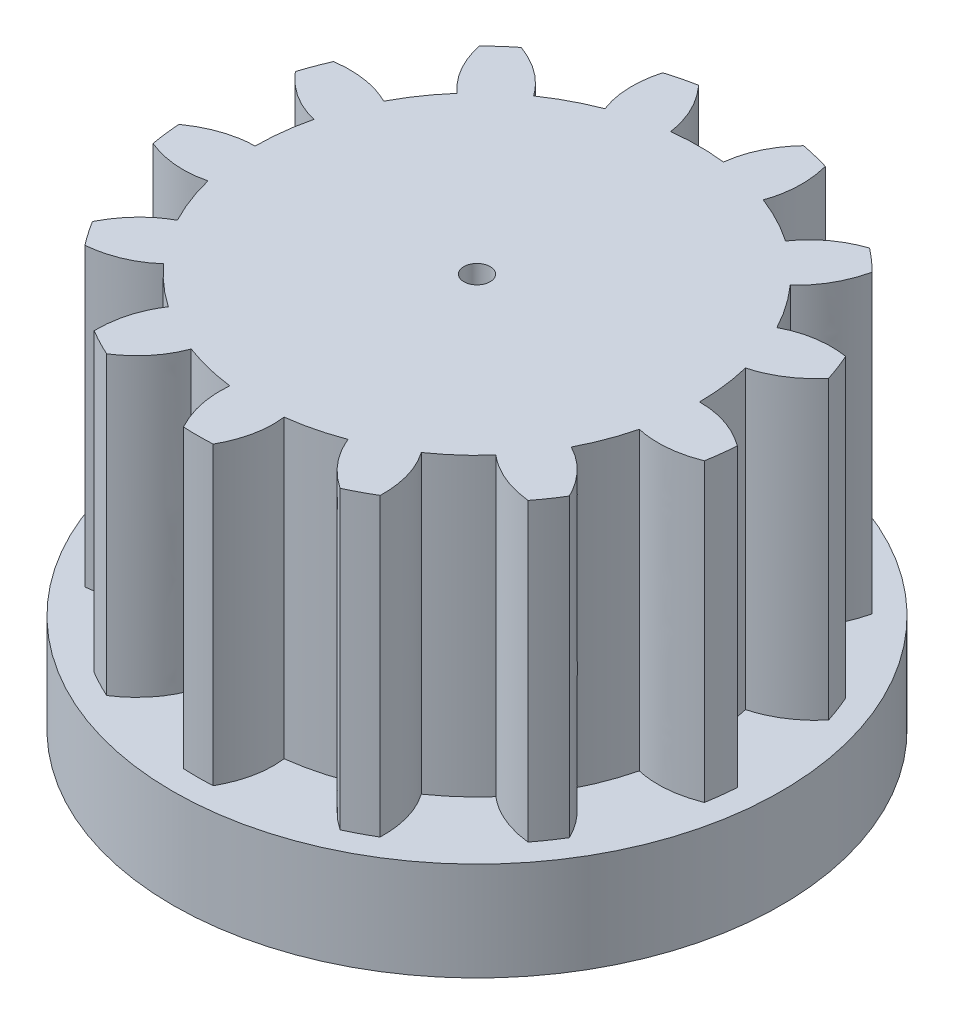
from build123d import *

# Parameters (mm, degrees)
SKETCH1_R             = 0.4
BOSS_EXTRUDE1_DEPTH   = 9
SKETCH2_R             = 9.25
BOSS_EXTRUDE2_DEPTH   = 3
CROQUIS1_R            = 2.3
CORTAR_EXTRUIR1_DEPTH = 2


with BuildPart() as part:
    # Sketch1 → Boss-Extrude1 (new body)
    with BuildSketch(Plane(origin=(0, 0, 0), x_dir=(1, 0, 0), z_dir=(0, 1, 0))):
        with BuildLine():
            add(Edge.make_bspline(
                [(-5.065227978, 4.461610195), (-5.526615005, 4.86619147), (-5.830003112, 5.39406146), (-5.975392301, 6.045220165)],
                knots=[0, 0, 0, 0, 0.872429449, 0.872429449, 0.872429449, 0.872429449], degree=3))
            ThreePointArc((-5.065227978, 4.461610195), (-5.560258819, 3.827012132), (-5.976238464, 3.138004752))
            add(Edge.make_bspline(
                [(-7.780961116, 3.42149735), (-7.125870497, 3.507536778), (-6.52429628, 3.413039245), (-5.976238464, 3.138004752)],
                knots=[0.127683247, 0.127683247, 0.127683247, 0.127683247, 1, 1, 1, 1], degree=3))
            ThreePointArc((-7.780961116, 3.42149735), (-7.951879756, 3.00293329), (-8.10030101, 2.575873357))
            add(Edge.make_bspline(
                [(-6.558450277, 1.596630818), (-7.155006493, 1.740452504), (-7.668956737, 2.066866683), (-8.10030101, 2.575873357)],
                knots=[0, 0, 0, 0, 0.872429449, 0.872429449, 0.872429449, 0.872429449], degree=3))
            ThreePointArc((-6.558450277, 1.596630818), (-6.701865893, 0.804669837), (-6.749999881, 0.00126872))
            add(Edge.make_bspline(
                [(-8.479748007, -0.586407486), (-7.939678588, -0.205787566), (-7.363095879, -0.009895497), (-6.749999881, 0.00126872)],
                knots=[0.127683247, 0.127683247, 0.127683247, 0.127683247, 1, 1, 1, 1], degree=3))
            ThreePointArc((-8.479748007, -0.586407486), (-8.436572529, -1.036457408), (-8.369528376, -1.483574994))
            add(Edge.make_bspline(
                [(-6.549210655, -1.634117437), (-7.144272221, -1.784003157), (-7.751044795, -1.733822342), (-8.369528376, -1.483574994)],
                knots=[0, 0, 0, 0, 0.872429449, 0.872429449, 0.872429449, 0.872429449], degree=3))
            ThreePointArc((-6.549210655, -1.634117437), (-6.308156258, -2.402012621), (-5.977417671, -3.13575796))
            add(Edge.make_bspline(
                [(-7.235926822, -4.459973434), (-6.934601997, -3.871968458), (-6.515098947, -3.4305633), (-5.977417671, -3.13575796)],
                knots=[0.127683247, 0.127683247, 0.127683247, 0.127683247, 1, 1, 1, 1], degree=3))
            ThreePointArc((-7.235926822, -4.459973434), (-6.988548208, -4.838408204), (-6.721397655, -5.203154193))
            add(Edge.make_bspline(
                [(-5.039625799, -4.490509081), (-5.496871281, -4.899765193), (-6.0574619, -5.137313564), (-6.721397655, -5.203154193)],
                knots=[0, 0, 0, 0, 0.872429449, 0.872429449, 0.872429449, 0.872429449], degree=3))
            ThreePointArc((-5.039625799, -4.490509081), (-4.469324045, -5.058422935), (-3.835481109, -5.554420281))
            add(Edge.make_bspline(
                [(-4.334442004, -7.311813216), (-4.34089166, -6.651128039), (-4.174571361, -6.065330394), (-3.835481109, -5.554420281)],
                knots=[0.127683247, 0.127683247, 0.127683247, 0.127683247, 1, 1, 1, 1], degree=3))
            ThreePointArc((-4.334442004, -7.311813216), (-3.939531713, -7.53193799), (-3.533475733, -7.730753472))
            add(Edge.make_bspline(
                [(-2.375523406, -6.318179211), (-2.590203375, -6.893050073), (-2.976187484, -7.36390816), (-3.533475733, -7.730753472)],
                knots=[0, 0, 0, 0, 0.872429449, 0.872429449, 0.872429449, 0.872429449], degree=3))
            ThreePointArc((-2.375523406, -6.318179211), (-1.606623554, -6.556009515), (-0.814882047, -6.700631854))
            add(Edge.make_bspline(
                [(-0.439988759, -8.488604708), (-0.752735357, -7.906594341), (-0.877699786, -7.31060339), (-0.814882047, -6.700631854)],
                knots=[0.127683247, 0.127683247, 0.127683247, 0.127683247, 1, 1, 1, 1], degree=3))
            ThreePointArc((-0.439988759, -8.488604708), (0.011984021, -8.499991552), (0.463922896, -8.487330296))
            add(Edge.make_bspline(
                [(0.832782771, -6.698430626), (0.909848909, -7.307220251), (0.786895617, -7.903520141), (0.463922896, -8.487330296)],
                knots=[0, 0, 0, 0, 0.872429449, 0.872429449, 0.872429449, 0.872429449], degree=3))
            ThreePointArc((0.832782771, -6.698430626), (1.624135031, -6.551693323), (2.392396671, -6.311809421))
            add(Edge.make_bspline(
                [(3.555260608, -7.72075916), (3.007863545, -7.350755165), (2.620242233, -6.881105252), (2.392396671, -6.311809421)],
                knots=[0.127683247, 0.127683247, 0.127683247, 0.127683247, 1, 1, 1, 1], degree=3))
            ThreePointArc((3.555260608, -7.72075916), (3.96075436, -7.520799485), (4.355042381, -7.299562032))
            add(Edge.make_bspline(
                [(3.850308451, -5.54415231), (4.201465773, -6.047394331), (4.369710416, -6.632530905), (4.355042381, -7.299562032)],
                knots=[0, 0, 0, 0, 0.872429449, 0.872429449, 0.872429449, 0.872429449], degree=3))
            ThreePointArc((3.850308451, -5.54415231), (4.482823853, -5.046463148), (5.051606144, -4.477027515))
            add(Edge.make_bspline(
                [(6.736042616, -5.184180734), (6.079397157, -5.110946566), (5.517918333, -4.875228826), (5.051606144, -4.477027515)],
                knots=[0.127683247, 0.127683247, 0.127683247, 0.127683247, 1, 1, 1, 1], degree=3))
            ThreePointArc((6.736042616, -5.184180734), (7.002163607, -4.818682892), (7.24847414, -4.439552076))
            add(Edge.make_bspline(
                [(5.985774866, -3.119775513), (6.530577461, -3.402183249), (6.951477219, -3.84210877), (7.24847414, -4.439552076)],
                knots=[0, 0, 0, 0, 0.872429449, 0.872429449, 0.872429449, 0.872429449], degree=3))
            ThreePointArc((5.985774866, -3.119775513), (6.314551754, -2.385149082), (6.553553527, -1.616612559))
            add(Edge.make_bspline(
                [(8.373678438, -1.459968977), (7.758214146, -1.700281702), (7.151505842, -1.75249623), (6.553553527, -1.616612559)],
                knots=[0.127683247, 0.127683247, 0.127683247, 0.127683247, 1, 1, 1, 1], degree=3))
            ThreePointArc((8.373678438, -1.459968977), (8.439461558, -1.01266412), (8.481367828, -0.562494242))
            add(Edge.make_bspline(
                [(6.749972396, 0.019304256), (7.363612555, 0.022427015), (7.940744366, -0.171505818), (8.481367828, -0.562494242)],
                knots=[0, 0, 0, 0, 0.872429449, 0.872429449, 0.872429449, 0.872429449], degree=3))
            ThreePointArc((6.749972396, 0.019304256), (6.699691947, 0.822573894), (6.554160776, 1.614148852))
            add(Edge.make_bspline(
                [(8.093005444, 2.598704077), (7.65971777, 2.099897208), (7.146769547, 1.771712133), (6.554160776, 1.614148852)],
                knots=[0.127683247, 0.127683247, 0.127683247, 0.127683247, 1, 1, 1, 1], degree=3))
            ThreePointArc((8.093005444, 2.598704077), (7.943380571, 3.025343799), (7.771282357, 3.443424244))
            add(Edge.make_bspline(
                [(5.967832596, 3.153961653), (6.509732754, 3.44189952), (7.110882674, 3.53838705), (7.771282357, 3.443424244)],
                knots=[0, 0, 0, 0, 0.872429449, 0.872429449, 0.872429449, 0.872429449], degree=3))
            ThreePointArc((5.967832596, 3.153961653), (5.550013455, 3.841855105), (5.053288778, 4.475128213))
            add(Edge.make_bspline(
                [(5.958322434, 6.062045345), (5.806472362, 5.419014975), (5.504794477, 4.890042598), (5.053288778, 4.475128213)],
                knots=[0.127683247, 0.127683247, 0.127683247, 0.127683247, 1, 1, 1, 1], degree=3))
            ThreePointArc((5.958322434, 6.062045345), (5.627566824, 6.370281912), (5.280889753, 6.660495734))
            add(Edge.make_bspline(
                [(3.818534268, 5.566084444), (4.16455163, 6.072874324), (4.652003458, 6.437678087), (5.280889753, 6.660495734)],
                knots=[0, 0, 0, 0, 0.872429449, 0.872429449, 0.872429449, 0.872429449], degree=3))
            ThreePointArc((3.818534268, 5.566084444), (3.128893766, 5.98101361), (2.394769219, 6.310909632))
            add(Edge.make_bspline(
                [(2.45865956, 8.136645081), (2.623034112, 7.496701718), (2.601737332, 6.888123235), (2.394769219, 6.310909632)],
                knots=[0.127683247, 0.127683247, 0.127683247, 0.127683247, 1, 1, 1, 1], degree=3))
            ThreePointArc((2.45865956, 8.136645081), (2.022545337, 8.25586521), (1.580708948, 8.351727918))
            add(Edge.make_bspline(
                [(0.794455758, 6.703084368), (0.865321915, 7.312626807), (1.127406312, 7.862174657), (1.580708948, 8.351727918)],
                knots=[0, 0, 0, 0, 0.872429449, 0.872429449, 0.872429449, 0.872429449], degree=3))
            ThreePointArc((0.794455758, 6.703084368), (-0.009017778, 6.749993976), (-0.812363108, 6.700937709))
            add(Edge.make_bspline(
                [(-1.604252589, 8.347237485), (-1.161309642, 7.856984441), (-0.897346481, 7.308217849), (-0.812363108, 6.700937709)],
                knots=[0.127683247, 0.127683247, 0.127683247, 0.127683247, 1, 1, 1, 1], degree=3))
            ThreePointArc((-1.604252589, 8.347237485), (-2.045816912, 8.250129282), (-2.481593228, 8.129679886))
            add(Edge.make_bspline(
                [(-2.411622992, 6.304488444), (-2.632142622, 6.877144615), (-2.655466033, 7.485541762), (-2.481593228, 8.129679886)],
                knots=[0, 0, 0, 0, 0.872429449, 0.872429449, 0.872429449, 0.872429449], degree=3))
            ThreePointArc((-2.411622992, 6.304488444), (-3.144863458, 5.972632069), (-3.833392837, 5.555861712))
            add(Edge.make_bspline(
                [(-5.299649804, 6.645578377), (-4.679611352, 6.417326717), (-4.19085903, 6.054087828), (-3.833392837, 5.555861712)],
                knots=[0.127683247, 0.127683247, 0.127683247, 0.127683247, 1, 1, 1, 1], degree=3))
            ThreePointArc((-5.299649804, 6.645578377), (-5.645507162, 6.35438816), (-5.975392301, 6.045220165))
        make_face()
        with Locations(Location((0, 0, 0), (0, 0, 270))):
            Circle(SKETCH1_R, mode=Mode.SUBTRACT)
    extrude(amount=BOSS_EXTRUDE1_DEPTH)

    # Sketch2 → Boss-Extrude2 (add)
    with BuildSketch(Plane.XZ):
        with Locations(Location((0, 0, 0), (0, 0, 270))):
            Circle(SKETCH2_R)
    extrude(amount=BOSS_EXTRUDE2_DEPTH)

    # Croquis1 → Cortar-Extruir1 (cut)
    with BuildSketch(Plane.XZ.offset(3)):
        with Locations(Location((0, 0, 0), (0, 0, 270))):
            Circle(CROQUIS1_R)
    extrude(amount=-CORTAR_EXTRUIR1_DEPTH, mode=Mode.SUBTRACT)


solid = part.part
